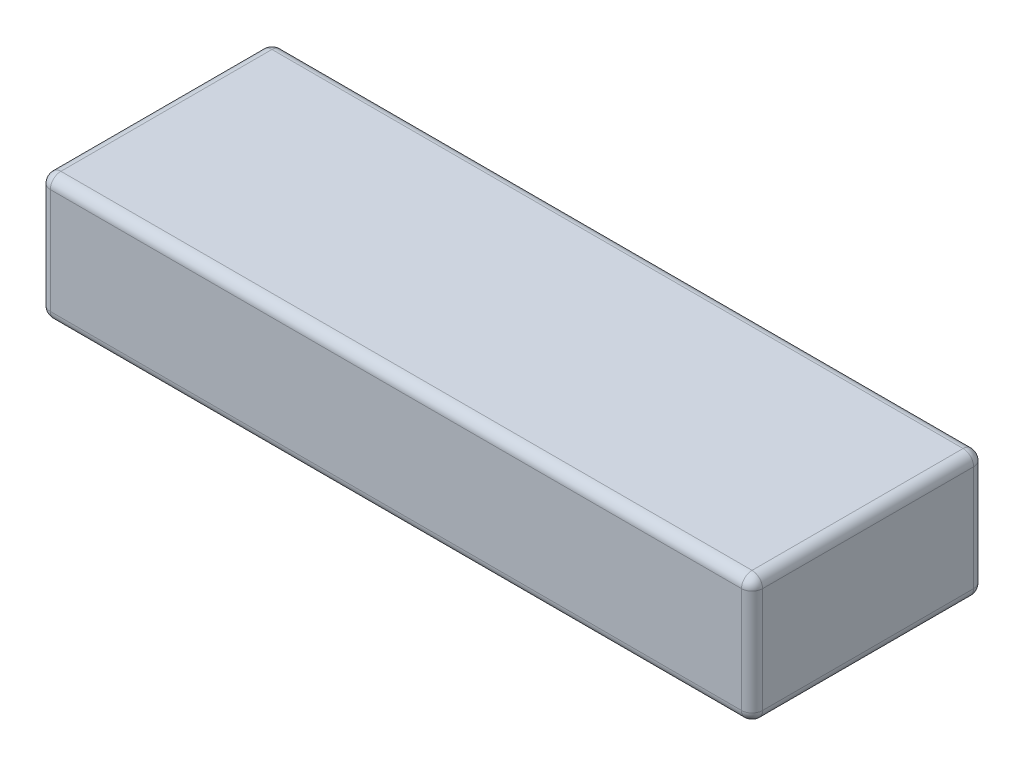
from build123d import *

# Parameters (mm, degrees)
SKETCH_1_W      = 135
SKETCH_1_H      = 44
EXTRUDE_1_DEPTH = 24
FILLET_1_R      = 2


with BuildPart() as part:
    # Эскиз1 → Бобышка-Вытянуть1 (new body)
    with BuildSketch(Plane(origin=(0, 0, 0), x_dir=(1, 0, 0), z_dir=(0, 1, 0))):
        Rectangle(SKETCH_1_W, SKETCH_1_H)
    extrude(amount=EXTRUDE_1_DEPTH)

    # Скругление1
    fillet_1_edges = [part.edges().sort_by_distance(p)[0] for p in [
        (-67.5, 24, 0),
        (0, 24, 22),
        (67.5, 24, 0),
        (0, 0, 22),
        (-67.5, 0, 0),
        (0, 0, -22),
        (67.5, 0, 0),
        (0, 24, -22),
        (67.5, 12, 22),
        (-67.5, 12, 22),
        (-67.5, 12, -22),
        (67.5, 12, -22),
    ]]
    fillet(fillet_1_edges, radius=FILLET_1_R)


solid = part.part
